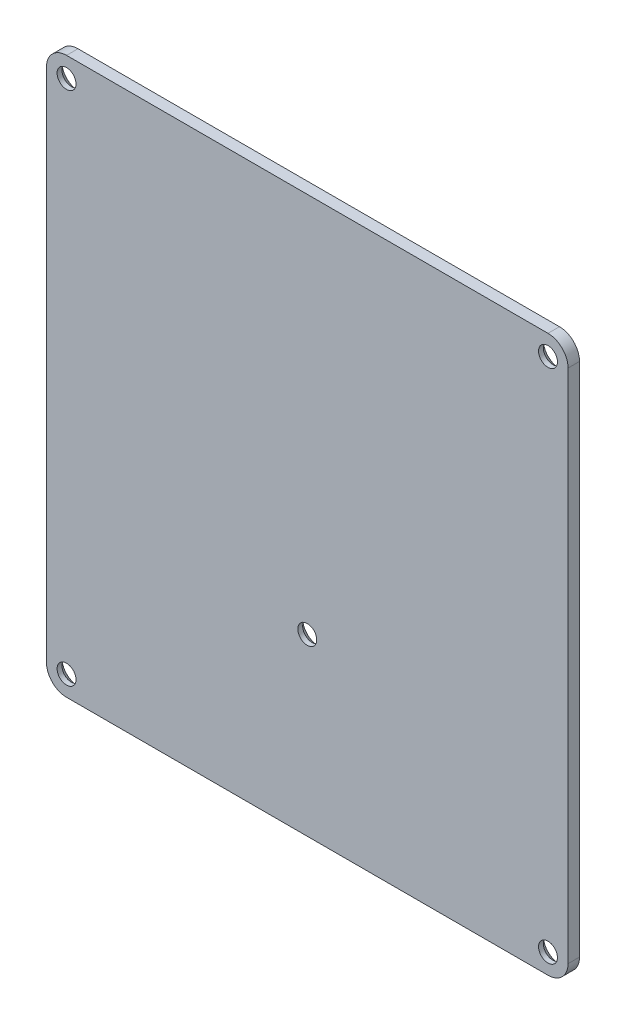
from build123d import *

# Parameters (mm, degrees)
EXTRUDE_1_DEPTH           = 2
HOLE_WIZARD_2_D           = 3.3
HOLE_WIZARD_2_DEPTH       = 15
HOLE_WIZARD_2_CSINK_D     = 5.6
HOLE_WIZARD_2_CSINK_ANGLE = 90
HOLE_WIZARD_2_TIP         = 0.991420021
SKETCH_5_W                = 0.314102564
SKETCH_5_H                = 2.557692308
EXTRUDE_3_DEPTH           = 0.2
HOLE_WIZARD_3_D           = 3.3
HOLE_WIZARD_3_DEPTH       = 15
HOLE_WIZARD_3_CSINK_D     = 5.6
HOLE_WIZARD_3_CSINK_ANGLE = 90
HOLE_WIZARD_3_TIP         = 0.991420021


with BuildPart() as part:
    # 草图1 → 凸台-拉伸1 (new body)
    with BuildSketch(Plane.XY):
        with BuildLine():
            Line((-42, 48.5), (42, 48.5))
            ThreePointArc((42, 48.5), (44.474873734, 47.474873734), (45.5, 45))
            Line((45.5, 45), (45.5, -45))
            ThreePointArc((45.5, -45), (44.474873734, -47.474873734), (42, -48.5))
            Line((42, -48.5), (-42, -48.5))
            ThreePointArc((-42, -48.5), (-44.474873734, -47.474873734), (-45.5, -45))
            Line((-45.5, -45), (-45.5, 45))
            ThreePointArc((-45.5, 45), (-44.474873734, 47.474873734), (-42, 48.5))
        make_face()
    extrude(amount=-EXTRUDE_1_DEPTH)

    # 打孔尺寸开槽半沉头螺钉的类型2
    with Locations(Plane(origin=(42, 45, -2), x_dir=(-1, 0, 0), z_dir=(0, 0, -1))):
        with Locations((0, 0), (84, 0), (84, -90), (0, -90)):
            CounterSinkHole(HOLE_WIZARD_2_D / 2, HOLE_WIZARD_2_CSINK_D / 2, depth=HOLE_WIZARD_2_DEPTH, counter_sink_angle=HOLE_WIZARD_2_CSINK_ANGLE)
            with Locations((0, 0, -(HOLE_WIZARD_2_DEPTH + HOLE_WIZARD_2_TIP / 2))):  # 118° drill point
                Cone(0, HOLE_WIZARD_2_D / 2, HOLE_WIZARD_2_TIP, mode=Mode.SUBTRACT)

    # 草图5 → 凸台-拉伸3 (add)
    # profile 1 of 6: a face of its own
    with BuildSketch(Plane(origin=(0, 0, -2), x_dir=(-1, 0, 0), z_dir=(0, 0, -1))):
        with BuildLine():
            Line((-6.136904816, 34.351745916), (-5.436484142, 34.351745916))
            add(Edge.make_bspline(
                [(-5.436484142, 34.351745916), (-5.389743014, 34.35159033), (-5.29999487, 34.351291588), (-5.171421599, 34.349625825), (-5.054594502, 34.344851469), (-4.949574663, 34.340742886), (-4.856364008, 34.333250944), (-4.774676717, 34.326090297), (-4.70488902, 34.316716636), (-4.662643168, 34.308011213), (-4.643515392, 34.304069634)],
                knots=[0, 0, 0, 0, 1.410062039, 2.707475311, 3.878576406, 4.937260626, 5.877586885, 6.699081471, 7.410979367, 8, 8, 8, 8], degree=3))
            add(Edge.make_bspline(
                [(-4.643515392, 34.304069634), (-4.617908768, 34.297742869), (-4.567241779, 34.285224305), (-4.494291713, 34.258764704), (-4.424777389, 34.22814508), (-4.358987565, 34.192181359), (-4.297251773, 34.15060658), (-4.238933463, 34.104138457), (-4.183767999, 34.053031251), (-4.133986369, 33.99599641), (-4.087047317, 33.9361599), (-4.047458691, 33.871456143), (-4.013332211, 33.803794616), (-3.986161694, 33.732487198), (-3.964283721, 33.658225426), (-3.948857481, 33.580336629), (-3.939606294, 33.499175654), (-3.938664438, 33.443817746), (-3.938186867, 33.41574832)],
                knots=[0, 0, 0, 0, 1.027469482, 2.033020251, 3.019912614, 3.986113645, 4.951240523, 5.91722682, 6.890402269, 7.87763091, 8.8651537, 9.85103654, 10.82876324, 11.815024772, 12.821070561, 13.842952187, 14.906261191, 16, 16, 16, 16], degree=3))
            add(Edge.make_bspline(
                [(-3.938186867, 33.41574832), (-3.939655865, 33.369113215), (-3.942522261, 33.278116047), (-3.969247364, 33.146055166), (-4.013023884, 33.022865851), (-4.073347173, 32.908703213), (-4.150166649, 32.805792568), (-4.24249144, 32.715402113), (-4.350373051, 32.6397622), (-4.450802367, 32.587309395), (-4.539516567, 32.553716487), (-4.61254988, 32.530080128), (-4.692216857, 32.511818163), (-4.777754192, 32.495458031), (-4.869517847, 32.483106337), (-4.967287887, 32.474059742), (-5.071134039, 32.468405693), (-5.142473108, 32.467563688), (-5.179172444, 32.467130531)],
                knots=[0, 0, 0, 0, 1.260483769, 2.459530307, 3.627416485, 4.787058657, 5.939039949, 7.08810263, 8.267026773, 9.491475466, 10.141966685, 10.831826277, 11.566392101, 12.351337768, 13.187381173, 14.07005841, 15.007169909, 16, 16, 16, 16], degree=3))
            Line((-5.179172444, 32.467130531), (-3.893315072, 30.851745916))
            Line((-3.893315072, 30.851745916), (-4.281736546, 30.851745916))
            Line((-4.281736546, 30.851745916), (-5.567593918, 32.467130531))
            Line((-5.567593918, 32.467130531), (-5.822802251, 32.467130531))
            Line((-5.822802251, 32.467130531), (-5.822802251, 30.851745916))
            Line((-5.822802251, 30.851745916), (-6.136904816, 30.851745916))
            Line((-6.136904816, 30.851745916), (-6.136904816, 34.351745916))
        make_face()
        with BuildLine():
            Line((-5.822802251, 33.992771557), (-5.822802251, 32.82610489))
            Line((-5.822802251, 32.82610489), (-5.181976931, 32.821197038))
            add(Edge.make_bspline(
                [(-5.181976931, 32.821197038), (-5.152056892, 32.821183801), (-5.094063335, 32.821158145), (-5.01016267, 32.825151921), (-4.932042558, 32.829695239), (-4.860001806, 32.836644585), (-4.794008231, 32.845600657), (-4.734094818, 32.856803641), (-4.680163766, 32.869855703), (-4.617265227, 32.890057329), (-4.547028696, 32.922063348), (-4.470697236, 32.968628846), (-4.405694898, 33.027197965), (-4.350777036, 33.094171421), (-4.306647605, 33.16780767), (-4.27553555, 33.247224039), (-4.255793108, 33.330415637), (-4.253464563, 33.387593745), (-4.252289431, 33.416449442)],
                knots=[0, 0, 0, 0, 1.146690395, 2.22261258, 3.21895312, 4.145990853, 4.996080663, 5.770904154, 6.481378293, 7.121626537, 8.300444488, 9.431385265, 10.535395872, 11.636531494, 12.74115979, 13.810798291, 14.895190096, 16, 16, 16, 16], degree=3))
            add(Edge.make_bspline(
                [(-4.252289431, 33.416449442), (-4.253491552, 33.444596015), (-4.255873717, 33.500372254), (-4.275322486, 33.582028164), (-4.308211867, 33.659095115), (-4.352534105, 33.7312596), (-4.40653326, 33.796765335), (-4.469851073, 33.852812488), (-4.540756268, 33.899061953), (-4.607027466, 33.928616334), (-4.666261679, 33.946736187), (-4.717691339, 33.959487351), (-4.775802817, 33.96973182), (-4.840878275, 33.97793988), (-4.912639906, 33.984994825), (-4.991450557, 33.989746603), (-5.076787337, 33.992560468), (-5.135934269, 33.992699556), (-5.166552251, 33.992771557)],
                knots=[0, 0, 0, 0, 1.101028733, 2.181837193, 3.264309656, 4.369019818, 5.486613113, 6.575447106, 7.666700264, 8.788928104, 9.402425223, 10.0903467, 10.862060571, 11.710948788, 12.657782767, 13.684531032, 14.801375019, 16, 16, 16, 16], degree=3))
            Line((-5.166552251, 33.992771557), (-5.822802251, 33.992771557))
        make_face(mode=Mode.SUBTRACT)
    # profile 2 of 6: a face of its own
    with BuildSketch(Plane(origin=(0, 0, -2), x_dir=(-1, 0, 0), z_dir=(0, 0, -1))):
        with BuildLine():
            Line((-3.309981739, 33.409438224), (-2.995879175, 33.409438224))
            Line((-2.995879175, 33.409438224), (-2.995879175, 32.223140147))
            add(Edge.make_bspline(
                [(-2.995879175, 32.223140147), (-2.99573727, 32.188317398), (-2.995465812, 32.12170311), (-2.993624871, 32.025847923), (-2.989294778, 31.93843121), (-2.983880953, 31.859402473), (-2.976918817, 31.788775082), (-2.968635457, 31.726795725), (-2.959377035, 31.672761541), (-2.950314321, 31.640218185), (-2.946099527, 31.625083256)],
                knots=[0, 0, 0, 0, 1.388932606, 2.656963016, 3.823490214, 4.879454478, 5.816252168, 6.653371382, 7.373723809, 8, 8, 8, 8], degree=3))
            add(Edge.make_bspline(
                [(-2.946099527, 31.625083256), (-2.939338072, 31.606060385), (-2.925955731, 31.568410124), (-2.901682247, 31.514021119), (-2.871653911, 31.463645836), (-2.838794083, 31.415341763), (-2.800894675, 31.370539777), (-2.758435204, 31.329315533), (-2.712836967, 31.290111442), (-2.645081944, 31.24372665), (-2.552422678, 31.19401132), (-2.430769922, 31.151115501), (-2.298865697, 31.125479681), (-2.207700977, 31.122505426), (-2.160843117, 31.120976685)],
                knots=[0, 0, 0, 0, 0.725840625, 1.436591201, 2.137033971, 2.831655856, 3.53531722, 4.242432219, 4.957935707, 5.694543706, 7.190802206, 8.724350549, 10.316345118, 12, 12, 12, 12], degree=3))
            add(Edge.make_bspline(
                [(-2.160843117, 31.120976685), (-2.113989609, 31.122537934), (-2.023336741, 31.125558661), (-1.892881772, 31.1503422), (-1.773630357, 31.191747889), (-1.666779406, 31.2495553), (-1.572813566, 31.320297363), (-1.494509147, 31.403306172), (-1.429901892, 31.495955559), (-1.401692472, 31.565079838), (-1.387505777, 31.599842871)],
                knots=[0, 0, 0, 0, 1.157059328, 2.238695713, 3.266970494, 4.264342957, 5.228770407, 6.160125903, 7.074715775, 8, 8, 8, 8], degree=3))
            add(Edge.make_bspline(
                [(-1.387505777, 31.599842871), (-1.383311547, 31.61380917), (-1.374039129, 31.644685245), (-1.364076777, 31.697064994), (-1.355102316, 31.759529598), (-1.347439139, 31.832487807), (-1.341973977, 31.915748959), (-1.33902795, 32.009287035), (-1.335699675, 32.112808396), (-1.335649159, 32.185276155), (-1.335622764, 32.223140147)],
                knots=[0, 0, 0, 0, 0.557542046, 1.232589297, 2.036731608, 2.971723315, 4.038036528, 5.22795436, 6.551621927, 8, 8, 8, 8], degree=3))
            Line((-1.335622764, 32.223140147), (-1.335622764, 33.409438224))
            Line((-1.335622764, 33.409438224), (-1.0215202, 33.409438224))
            Line((-1.0215202, 33.409438224), (-1.0215202, 32.164245916))
            add(Edge.make_bspline(
                [(-1.0215202, 32.164245916), (-1.021961895, 32.121938745), (-1.022818843, 32.039857045), (-1.028326187, 31.920572933), (-1.0377758, 31.809410688), (-1.052118484, 31.706311468), (-1.068984159, 31.611353987), (-1.090740432, 31.524416541), (-1.11671867, 31.445766987), (-1.146024185, 31.37402521), (-1.180646052, 31.308978316), (-1.217473073, 31.247242499), (-1.259997845, 31.190349564), (-1.304768079, 31.135467427), (-1.354569735, 31.085325899), (-1.408469594, 31.038774423), (-1.465709014, 30.995101392), (-1.527558212, 30.956010112), (-1.593114275, 30.920793467), (-1.662458132, 30.889577389), (-1.73643913, 30.864874812), (-1.814102767, 30.843564146), (-1.895829546, 30.826849677), (-1.981540679, 30.81506311), (-2.071207295, 30.807837779), (-2.132316755, 30.807200734), (-2.163647604, 30.806874121)],
                knots=[0, 0, 0, 0, 1.493040784, 2.896703357, 4.213163133, 5.428574705, 6.569057535, 7.615249723, 8.588095153, 9.490268104, 10.346124644, 11.18633936, 12.024365274, 12.850166724, 13.684164916, 14.514361689, 15.362232829, 16.222528818, 17.093394965, 17.986930858, 18.902426812, 19.842810585, 20.827885679, 21.843828298, 22.894529745, 24, 24, 24, 24], degree=3))
            add(Edge.make_bspline(
                [(-2.163647604, 30.806874121), (-2.194744118, 30.807213828), (-2.255851663, 30.807881385), (-2.345522907, 30.815023192), (-2.431471514, 30.826831363), (-2.513391912, 30.84368658), (-2.59136631, 30.86472565), (-2.665710549, 30.889729186), (-2.735554112, 30.920809667), (-2.801736116, 30.955787225), (-2.863738505, 30.9953525), (-2.921847083, 31.03872054), (-2.975983935, 31.085826603), (-3.026161003, 31.13647396), (-3.07167398, 31.191290896), (-3.113090022, 31.249836457), (-3.151046727, 31.311530545), (-3.185399517, 31.377593708), (-3.214911273, 31.450165718), (-3.240966519, 31.530462815), (-3.262277157, 31.619365331), (-3.279619625, 31.71679726), (-3.293571066, 31.822292302), (-3.303257208, 31.936460717), (-3.308673039, 32.059024409), (-3.3095361, 32.143674299), (-3.309981739, 32.187382935)],
                knots=[0, 0, 0, 0, 1.083640291, 2.129454052, 3.13281866, 4.105697902, 5.042300162, 5.946461698, 6.836384745, 7.703652036, 8.553297018, 9.397182691, 10.228592656, 11.052265423, 11.879314572, 12.708807002, 13.549817954, 14.402308542, 15.300838682, 16.27712199, 17.341985831, 18.484375296, 19.725102775, 21.0496083, 22.476576903, 24, 24, 24, 24], degree=3))
            Line((-3.309981739, 32.187382935), (-3.309981739, 33.409438224))
        make_face()
    # profile 3 of 6: a face of its own
    with BuildSketch(Plane(origin=(0, 0, -2), x_dir=(-1, 0, 0), z_dir=(0, 0, -1))):
        with BuildLine():
            add(Edge.make_bspline(
                [(-0.192794239, 34.486361301), (-0.173302923, 34.485457148), (-0.135135183, 34.483686644), (-0.079941915, 34.468525167), (-0.029684903, 34.442825482), (0.01489283, 34.408345801), (0.053144716, 34.367796357), (0.079925427, 34.320535389), (0.097137823, 34.26947675), (0.099216378, 34.233861661), (0.100274672, 34.215728288)],
                knots=[0, 0, 0, 0, 1.055194115, 2.066272739, 3.074728998, 4.095836921, 5.109056067, 6.073838105, 7.019297344, 8, 8, 8, 8], degree=3))
            add(Edge.make_bspline(
                [(0.100274672, 34.215728288), (0.099192512, 34.198065635), (0.09705321, 34.16314866), (0.079938722, 34.112975188), (0.052916484, 34.066370904), (0.014917358, 34.025900194), (-0.029691403, 33.991439574), (-0.079940189, 33.965734835), (-0.135135637, 33.950574698), (-0.173303076, 33.948804009), (-0.192794239, 33.947899762)],
                knots=[0, 0, 0, 0, 0.96129708, 1.900370562, 2.859976407, 3.87933698, 4.906634145, 5.921202961, 6.938410037, 8, 8, 8, 8], degree=3))
            add(Edge.make_bspline(
                [(-0.192794239, 33.947899762), (-0.212062514, 33.948769482), (-0.249565694, 33.950462279), (-0.303932536, 33.966032297), (-0.353761026, 33.99144837), (-0.398425698, 34.025674555), (-0.435655891, 34.066619452), (-0.462754217, 34.112946746), (-0.479829179, 34.163155901), (-0.481973807, 34.198068067), (-0.483058662, 34.215728288)],
                knots=[0, 0, 0, 0, 1.054934014, 2.053291228, 3.073705704, 4.106921865, 5.123545215, 6.088680038, 7.033164197, 8, 8, 8, 8], degree=3))
            add(Edge.make_bspline(
                [(-0.483058662, 34.215728288), (-0.481997575, 34.233859137), (-0.479913534, 34.26946927), (-0.462741418, 34.320564303), (-0.43588161, 34.367545805), (-0.398401047, 34.408571304), (-0.353767586, 34.442816739), (-0.303930841, 34.46822772), (-0.249566142, 34.48379906), (-0.212062666, 34.485491674), (-0.192794239, 34.486361301)],
                knots=[0, 0, 0, 0, 0.98631895, 1.937192651, 2.907499808, 3.917963147, 4.944918757, 5.95915025, 6.951458133, 8, 8, 8, 8], degree=3))
        make_face()
    # profile 4 of 6: a face of its own
    with BuildSketch(Plane(origin=(0, 0, -2), x_dir=(-1, 0, 0), z_dir=(0, 0, -1))):
        with Locations((-0.191391995, 32.13059207)):
            Rectangle(SKETCH_5_W, SKETCH_5_H)
    # profile 5 of 6: a face of its own
    with BuildSketch(Plane(origin=(0, 0, -2), x_dir=(-1, 0, 0), z_dir=(0, 0, -1))):
        with BuildLine():
            Line((2.972069543, 33.409438224), (3.286172108, 33.409438224))
            Line((3.286172108, 33.409438224), (3.286172108, 31.379690628))
            add(Edge.make_bspline(
                [(3.286172108, 31.379690628), (3.285895065, 31.336453033), (3.285360306, 31.25299406), (3.281509335, 31.132315781), (3.273388658, 31.020849695), (3.264179976, 30.918087437), (3.25093326, 30.824505326), (3.234756893, 30.739824122), (3.216521214, 30.663962559), (3.200500996, 30.617237718), (3.192922909, 30.595135339)],
                knots=[0, 0, 0, 0, 1.307562039, 2.523909702, 3.650326591, 4.686913197, 5.643429486, 6.506965704, 7.293745905, 8, 8, 8, 8], degree=3))
            add(Edge.make_bspline(
                [(3.192922909, 30.595135339), (3.18173367, 30.566405418), (3.159689744, 30.509804581), (3.11840411, 30.42957026), (3.072170207, 30.35402387), (3.019363456, 30.283586419), (2.960222652, 30.218611506), (2.89614116, 30.157687507), (2.825870968, 30.10210334), (2.749452256, 30.052818042), (2.668646623, 30.008430988), (2.583500521, 29.969984421), (2.494494082, 29.936497577), (2.400791191, 29.911414781), (2.303860956, 29.889680061), (2.202563525, 29.875535375), (2.097490729, 29.865908317), (2.026045348, 29.865018084), (1.989797909, 29.864566429)],
                knots=[0, 0, 0, 0, 0.981931301, 1.934503488, 2.87077864, 3.801706999, 4.735015492, 5.667491629, 6.616593066, 7.585388521, 8.561939025, 9.551802639, 10.560317337, 11.588439944, 12.640189604, 13.723962949, 14.845264515, 16, 16, 16, 16], degree=3))
            add(Edge.make_bspline(
                [(1.989797909, 29.864566429), (1.936913174, 29.865422915), (1.833615079, 29.867095862), (1.683010086, 29.886586777), (1.539975366, 29.91414115), (1.40640091, 29.955846577), (1.283130813, 30.006883567), (1.171006937, 30.06547852), (1.07103583, 30.132667829), (0.980912157, 30.20916843), (0.899570567, 30.300132111), (0.823043277, 30.407330956), (0.749382335, 30.532397845), (0.706213697, 30.624190558), (0.683608005, 30.672258737)],
                knots=[0, 0, 0, 0, 1.157897085, 2.2616841, 3.32207898, 4.345638746, 5.321241055, 6.241986252, 7.112515963, 7.955008012, 8.825025602, 9.77857164, 10.836726669, 12, 12, 12, 12], degree=3))
            Line((0.683608005, 30.672258737), (0.997710569, 30.672258737))
            add(Edge.make_bspline(
                [(0.997710569, 30.672258737), (1.022972778, 30.632152861), (1.072357287, 30.553750812), (1.164705768, 30.452237656), (1.265912094, 30.365484292), (1.379391777, 30.295573518), (1.505616993, 30.242863726), (1.644663679, 30.20528843), (1.797663301, 30.182792163), (1.904181515, 30.180080869), (1.959649672, 30.178668993)],
                knots=[0, 0, 0, 0, 0.997731894, 1.950442991, 2.880492273, 3.800895997, 4.748200782, 5.754801363, 6.83083817, 8, 8, 8, 8], degree=3))
            add(Edge.make_bspline(
                [(1.959649672, 30.178668993), (2.014416562, 30.180099142), (2.120001645, 30.182856326), (2.271832814, 30.20529847), (2.410427752, 30.242871903), (2.534987952, 30.29548029), (2.644043721, 30.359930696), (2.738055712, 30.431930771), (2.814200388, 30.513111774), (2.865413355, 30.58789358), (2.897247973, 30.654517709), (2.917520209, 30.711870305), (2.933994179, 30.776723183), (2.947774016, 30.848858919), (2.95914493, 30.928380576), (2.966347812, 31.01546998), (2.971553624, 31.109929202), (2.971893593, 31.17542234), (2.972069543, 31.209318031)],
                knots=[0, 0, 0, 0, 1.570740765, 3.028230971, 4.391408896, 5.680370741, 6.894727393, 8.017376726, 9.065722033, 10.075533815, 10.603371122, 11.180248986, 11.817768598, 12.521299649, 13.286540596, 14.121245857, 15.027658897, 16, 16, 16, 16], degree=3))
            Line((2.972069543, 31.209318031), (2.972069543, 31.341830051))
            add(Edge.make_bspline(
                [(2.972069543, 31.341830051), (2.940188426, 31.303888249), (2.87698697, 31.228672029), (2.767839643, 31.130110392), (2.648622728, 31.045224262), (2.519539185, 30.975605627), (2.383750943, 30.919924203), (2.242728713, 30.880981242), (2.097736657, 30.855821342), (1.999484508, 30.853114026), (1.949833966, 30.851745916)],
                knots=[0, 0, 0, 0, 1.012485704, 2.007162095, 2.997754123, 3.998611389, 4.999708251, 5.992315798, 6.98544096, 8, 8, 8, 8], degree=3))
            add(Edge.make_bspline(
                [(1.949833966, 30.851745916), (1.920597697, 30.852260943), (1.86247114, 30.853284901), (1.776116392, 30.862243678), (1.691035954, 30.87524242), (1.60742825, 30.894323859), (1.525172637, 30.918815586), (1.444405045, 30.949432325), (1.364471519, 30.984047443), (1.286825021, 31.024820246), (1.21223889, 31.070182553), (1.141275705, 31.119321444), (1.074307166, 31.171979732), (1.011970676, 31.228676672), (0.954348005, 31.289330205), (0.900664137, 31.353293758), (0.85180679, 31.421460499), (0.8067734, 31.492587457), (0.76771585, 31.56714838), (0.733431478, 31.643526476), (0.703622073, 31.72155843), (0.679856672, 31.801505493), (0.661705558, 31.883317262), (0.648195331, 31.966859711), (0.6405324, 32.052390098), (0.639337476, 32.110011448), (0.63873621, 32.139005531)],
                knots=[0, 0, 0, 0, 1.028754217, 2.045334182, 3.052854819, 4.056607503, 5.061168794, 6.071104265, 7.095078842, 8.125279047, 9.155117945, 10.165957491, 11.161587969, 12.151493252, 13.128948131, 14.104219989, 15.088194871, 16.07871515, 17.064853787, 18.047899887, 19.02414258, 20.002704429, 20.980574569, 21.971845993, 22.979467364, 24, 24, 24, 24], degree=3))
            add(Edge.make_bspline(
                [(0.63873621, 32.139005531), (0.639255376, 32.168008627), (0.640291698, 32.225902486), (0.649242677, 32.311781872), (0.662010867, 32.396511307), (0.682218636, 32.479217449), (0.706541158, 32.5608422), (0.736664731, 32.640782657), (0.77288349, 32.719063166), (0.81389324, 32.795741697), (0.859977333, 32.869789312), (0.910509813, 32.940115958), (0.965551688, 33.00620413), (1.024343603, 33.068720552), (1.08760342, 33.127062045), (1.155298413, 33.18108701), (1.226761293, 33.231701036), (1.302213543, 33.277812373), (1.380490931, 33.31859462), (1.459604749, 33.355807217), (1.540602984, 33.385341336), (1.621975524, 33.411364435), (1.705155438, 33.429799631), (1.789122832, 33.444021873), (1.87416517, 33.452686594), (1.931118065, 33.453768179), (1.959649672, 33.454310019)],
                knots=[0, 0, 0, 0, 1.008818848, 2.013730394, 3.001654427, 3.987803273, 4.973046549, 5.963777569, 6.957074694, 7.972068341, 8.987420212, 9.989399531, 10.982630087, 11.977756091, 12.973280677, 13.973972381, 14.989194003, 16.018387222, 17.047741039, 18.059210846, 19.057554164, 20.045176975, 21.029480261, 22.018708529, 23.007435371, 24, 24, 24, 24], degree=3))
            add(Edge.make_bspline(
                [(1.959649672, 33.454310019), (2.006700611, 33.452953345), (2.099611758, 33.450274332), (2.23634276, 33.429253187), (2.368285, 33.395739174), (2.496183016, 33.347723543), (2.621078667, 33.282173505), (2.742560322, 33.195830557), (2.860979456, 33.087920217), (2.934057287, 33.005167353), (2.972069543, 32.962122519)],
                knots=[0, 0, 0, 0, 0.96728863, 1.910097829, 2.838038873, 3.762875196, 4.71315279, 5.730631239, 6.819562287, 8, 8, 8, 8], degree=3))
            Line((2.972069543, 32.962122519), (2.972069543, 33.409438224))
        make_face()
        with BuildLine():
            add(Edge.make_bspline(
                [(1.984890056, 33.140207455), (1.938959352, 33.138646389), (1.848026298, 33.13555581), (1.714737955, 33.109171097), (1.586061022, 33.067825197), (1.464455594, 33.008682582), (1.350548484, 32.936588344), (1.249473663, 32.849248056), (1.161068747, 32.749501859), (1.086285809, 32.638251612), (1.026754443, 32.518229337), (0.984611023, 32.391718603), (0.957361, 32.26076361), (0.954353348, 32.171391007), (0.952838774, 32.126385339)],
                knots=[0, 0, 0, 0, 1.026226791, 2.031711442, 3.026614839, 4.04107745, 5.047145931, 6.032893242, 7.017642609, 8.019221815, 9.021877557, 10.003543541, 10.994637589, 12, 12, 12, 12], degree=3))
            add(Edge.make_bspline(
                [(0.952838774, 32.126385339), (0.953564531, 32.092452067), (0.954991882, 32.025715243), (0.96871546, 31.927777348), (0.990896425, 31.834497034), (1.022333632, 31.74586866), (1.061286327, 31.661383865), (1.110278698, 31.58162463), (1.167929669, 31.506519924), (1.233788007, 31.436625242), (1.306364389, 31.372964274), (1.385083588, 31.317026233), (1.469838838, 31.271275512), (1.558545648, 31.231734675), (1.653356404, 31.202855607), (1.75290549, 31.180816828), (1.857897187, 31.16820807), (1.929468926, 31.166645272), (1.965959768, 31.16584848)],
                knots=[0, 0, 0, 0, 1.039728707, 2.044842319, 3.024901384, 3.974314358, 4.923051295, 5.871625912, 6.837440708, 7.820715446, 8.810779094, 9.792721783, 10.773906224, 11.758876063, 12.764959493, 13.806266761, 14.881525401, 16, 16, 16, 16], degree=3))
            add(Edge.make_bspline(
                [(1.965959768, 31.16584848), (2.002923526, 31.166616089), (2.075205763, 31.168117141), (2.1807767, 31.181020639), (2.28080944, 31.201842615), (2.375212263, 31.231405641), (2.464341604, 31.269127391), (2.547196218, 31.316864009), (2.625552666, 31.371228441), (2.696909076, 31.434640455), (2.761433241, 31.50452545), (2.817664008, 31.580570345), (2.865578457, 31.661630864), (2.905256127, 31.74769787), (2.935547331, 31.839440223), (2.955866236, 31.936628579), (2.970072981, 32.038797318), (2.971393906, 32.108805934), (2.972069543, 32.144614506)],
                knots=[0, 0, 0, 0, 1.121943988, 2.193949579, 3.223793937, 4.220241907, 5.192961521, 6.155822191, 7.11847367, 8.083710714, 9.04790392, 10.001595906, 10.949595423, 11.902125208, 12.873731292, 13.87582262, 14.913508608, 16, 16, 16, 16], degree=3))
            add(Edge.make_bspline(
                [(2.972069543, 32.144614506), (2.970729975, 32.19123236), (2.96811293, 32.282307265), (2.943415772, 32.415014033), (2.903595562, 32.539782707), (2.84774881, 32.656218682), (2.777766801, 32.763088232), (2.693475952, 32.858412077), (2.596329922, 32.942312933), (2.486607821, 33.012211127), (2.368560376, 33.068676561), (2.24503918, 33.111038333), (2.116227616, 33.135032648), (2.028921207, 33.138472592), (1.984890056, 33.140207455)],
                knots=[0, 0, 0, 0, 1.070913519, 2.092188694, 3.091357305, 4.074328408, 5.051968682, 6.018948707, 6.99050112, 7.9935919, 9.000589572, 9.992915277, 10.987769056, 12, 12, 12, 12], degree=3))
        make_face(mode=Mode.SUBTRACT)
    # profile 6 of 6: a face of its own
    with BuildSketch(Plane(origin=(0, 0, -2), x_dir=(-1, 0, 0), z_dir=(0, 0, -1))):
        with BuildLine():
            Line((6.103279479, 31.659438224), (6.382325954, 31.512903769))
            add(Edge.make_bspline(
                [(6.382325954, 31.512903769), (6.360089358, 31.473460437), (6.31682575, 31.396719335), (6.242425002, 31.291287474), (6.164432929, 31.196439758), (6.079328961, 31.114710104), (5.989659283, 31.043458719), (5.894926628, 30.981120894), (5.79463781, 30.928002374), (5.688788085, 30.883249846), (5.576488534, 30.848840352), (5.457467018, 30.824536131), (5.331495522, 30.809512862), (5.245149342, 30.807767722), (5.200935729, 30.806874121)],
                knots=[0, 0, 0, 0, 1.120438281, 2.179929193, 3.190490725, 4.156257408, 5.095198341, 6.022838206, 6.959905092, 7.901321166, 8.864066838, 9.862729781, 10.905609505, 12, 12, 12, 12], degree=3))
            add(Edge.make_bspline(
                [(5.200935729, 30.806874121), (5.151793752, 30.808021297), (5.05593199, 30.810259103), (4.916392243, 30.829551568), (4.785012825, 30.861023926), (4.661801121, 30.904989468), (4.547058869, 30.962416792), (4.440558014, 31.032376274), (4.341738488, 31.114508528), (4.253714279, 31.209524972), (4.174470396, 31.311206929), (4.104544576, 31.417162814), (4.046087145, 31.527126038), (3.998534535, 31.640396562), (3.96012967, 31.756260456), (3.933362966, 31.875771923), (3.917933218, 31.998607508), (3.915568773, 32.081704843), (3.914377236, 32.123580852)],
                knots=[0, 0, 0, 0, 1.145258523, 2.234067595, 3.276747158, 4.290159414, 5.277019952, 6.260822364, 7.254936242, 8.264827045, 9.274100331, 10.257902744, 11.220704747, 12.172965371, 13.118907548, 14.062713208, 15.023725156, 16, 16, 16, 16], degree=3))
            add(Edge.make_bspline(
                [(3.914377236, 32.123580852), (3.915436377, 32.162875682), (3.917535455, 32.240752847), (3.930766243, 32.356018392), (3.954214536, 32.468046844), (3.98639086, 32.576931292), (4.027942106, 32.682489426), (4.078774325, 32.78478549), (4.138966703, 32.88371063), (4.185439377, 32.946113763), (4.20884839, 32.977547198)],
                knots=[0, 0, 0, 0, 1.024358464, 2.0301432, 3.019427413, 4.004406732, 4.986367066, 5.972626655, 6.978780325, 8, 8, 8, 8], degree=3))
            add(Edge.make_bspline(
                [(4.20884839, 32.977547198), (4.240556072, 33.015416068), (4.302967019, 33.089954219), (4.408523374, 33.187892544), (4.522823571, 33.26993632), (4.644435197, 33.337943456), (4.774771671, 33.389617103), (4.912080962, 33.428124685), (5.057926548, 33.449702696), (5.157631769, 33.45275053), (5.208648069, 33.454310019)],
                knots=[0, 0, 0, 0, 1.030682036, 2.02871468, 2.997146059, 3.962720338, 4.930598197, 5.918074684, 6.934738563, 8, 8, 8, 8], degree=3))
            add(Edge.make_bspline(
                [(5.208648069, 33.454310019), (5.261095674, 33.45295597), (5.36398592, 33.450299634), (5.514018041, 33.425673301), (5.655978758, 33.386620747), (5.789811262, 33.331466956), (5.915529123, 33.260307404), (6.032315173, 33.172165563), (6.142166685, 33.069747476), (6.206075264, 32.990984266), (6.238595986, 32.95090457)],
                knots=[0, 0, 0, 0, 1.056321875, 2.072262726, 3.055038591, 4.01806755, 4.982017516, 5.957941055, 6.960871419, 8, 8, 8, 8], degree=3))
            add(Edge.make_bspline(
                [(6.238595986, 32.95090457), (6.260722924, 32.920700989), (6.304829517, 32.86049487), (6.360076617, 32.762323713), (6.408034012, 32.659613118), (6.446366973, 32.550702821), (6.477406474, 32.436883241), (6.499863293, 32.317340696), (6.513032912, 32.192110785), (6.515621609, 32.10678423), (6.516941338, 32.063284378)],
                knots=[0, 0, 0, 0, 0.94817472, 1.890038105, 2.849395472, 3.817997239, 4.812318967, 5.836947057, 6.897266129, 8, 8, 8, 8], degree=3))
            Line((6.516941338, 32.063284378), (4.2284798, 32.063284378))
            add(Edge.make_bspline(
                [(4.2284798, 32.063284378), (4.230019406, 32.029583913), (4.23304698, 31.96331331), (4.247162123, 31.866342527), (4.269410897, 31.773969184), (4.30067996, 31.686886142), (4.338546805, 31.603956015), (4.384932522, 31.525793978), (4.440272076, 31.452756048), (4.501997775, 31.38418891), (4.57070487, 31.323128149), (4.642987618, 31.268476373), (4.719881183, 31.222670776), (4.800779266, 31.185490886), (4.885551051, 31.15638457), (4.974223246, 31.13651675), (5.066621363, 31.123209643), (5.129607097, 31.121729978), (5.161672909, 31.120976685)],
                knots=[0, 0, 0, 0, 1.094153842, 2.151609401, 3.174256925, 4.172055639, 5.149267565, 6.128595816, 7.11444997, 8.118368179, 9.117203808, 10.09244225, 11.054858984, 12.015122123, 12.976791628, 13.957293641, 14.960065497, 16, 16, 16, 16], degree=3))
            add(Edge.make_bspline(
                [(5.161672909, 31.120976685), (5.193024056, 31.121584742), (5.255230747, 31.122791243), (5.347871605, 31.134523154), (5.439011132, 31.15349343), (5.528272115, 31.17938342), (5.613842961, 31.210960272), (5.693088511, 31.249063129), (5.765968727, 31.291212876), (5.834085694, 31.339422551), (5.900156687, 31.398430738), (5.965699173, 31.472066459), (6.035975827, 31.559153987), (6.079965419, 31.624699653), (6.103279479, 31.659438224)],
                knots=[0, 0, 0, 0, 0.99110716, 1.966546729, 2.947904876, 3.932708344, 4.903319531, 5.828989031, 6.710028674, 7.56322171, 8.463672341, 9.504779593, 10.677557249, 12, 12, 12, 12], degree=3))
        make_face()
        with BuildLine():
            add(Edge.make_bspline(
                [(6.202838774, 32.377386942), (6.19134215, 32.419049815), (6.169214848, 32.499237436), (6.122978484, 32.610278326), (6.070906943, 32.708966227), (6.009285212, 32.794545861), (5.939466486, 32.870549374), (5.858821303, 32.936967959), (5.76838541, 32.99638541), (5.668626269, 33.046537909), (5.562984484, 33.089227768), (5.452378292, 33.117852884), (5.339520504, 33.137462426), (5.263186218, 33.139288534), (5.22477387, 33.140207455)],
                knots=[0, 0, 0, 0, 1.154881502, 2.222775134, 3.210006277, 4.132804581, 5.035138423, 5.962687519, 6.919655026, 7.923214229, 8.944639381, 9.960483929, 10.97369054, 12, 12, 12, 12], degree=3))
            add(Edge.make_bspline(
                [(5.22477387, 33.140207455), (5.193424432, 33.139595783), (5.131453183, 33.138386637), (5.040152115, 33.126916508), (4.952472416, 33.107956663), (4.867767128, 33.081991706), (4.78714626, 33.047383104), (4.708951491, 33.006799877), (4.635171095, 32.957258293), (4.5890298, 32.919499438), (4.565719383, 32.900423801)],
                knots=[0, 0, 0, 0, 1.04873581, 2.073130211, 3.073294108, 4.04793562, 5.032784715, 6.005352987, 6.992311501, 8, 8, 8, 8], degree=3))
            add(Edge.make_bspline(
                [(4.565719383, 32.900423801), (4.549026101, 32.885329485), (4.515242967, 32.854782269), (4.470102445, 32.802153062), (4.426881973, 32.7454015), (4.38754832, 32.682356376), (4.351470734, 32.613735597), (4.317710756, 32.540117961), (4.287324344, 32.460944831), (4.270228234, 32.405772392), (4.261432524, 32.377386942)],
                knots=[0, 0, 0, 0, 0.879870761, 1.780643979, 2.707998968, 3.669668524, 4.684282772, 5.740141944, 6.837334558, 8, 8, 8, 8], degree=3))
            Line((4.261432524, 32.377386942), (6.202838774, 32.377386942))
        make_face(mode=Mode.SUBTRACT)
    extrude(amount=EXTRUDE_3_DEPTH)

    # 打孔尺寸开槽半沉头螺钉的类型3
    with Locations(Plane(origin=(0, -18, -2), x_dir=(-1, 0, 0), z_dir=(0, 0, -1))):
        with Locations((0, 0)):
            CounterSinkHole(HOLE_WIZARD_3_D / 2, HOLE_WIZARD_3_CSINK_D / 2, depth=HOLE_WIZARD_3_DEPTH, counter_sink_angle=HOLE_WIZARD_3_CSINK_ANGLE)
            with Locations((0, 0, -(HOLE_WIZARD_3_DEPTH + HOLE_WIZARD_3_TIP / 2))):  # 118° drill point
                Cone(0, HOLE_WIZARD_3_D / 2, HOLE_WIZARD_3_TIP, mode=Mode.SUBTRACT)


solid = part.part
